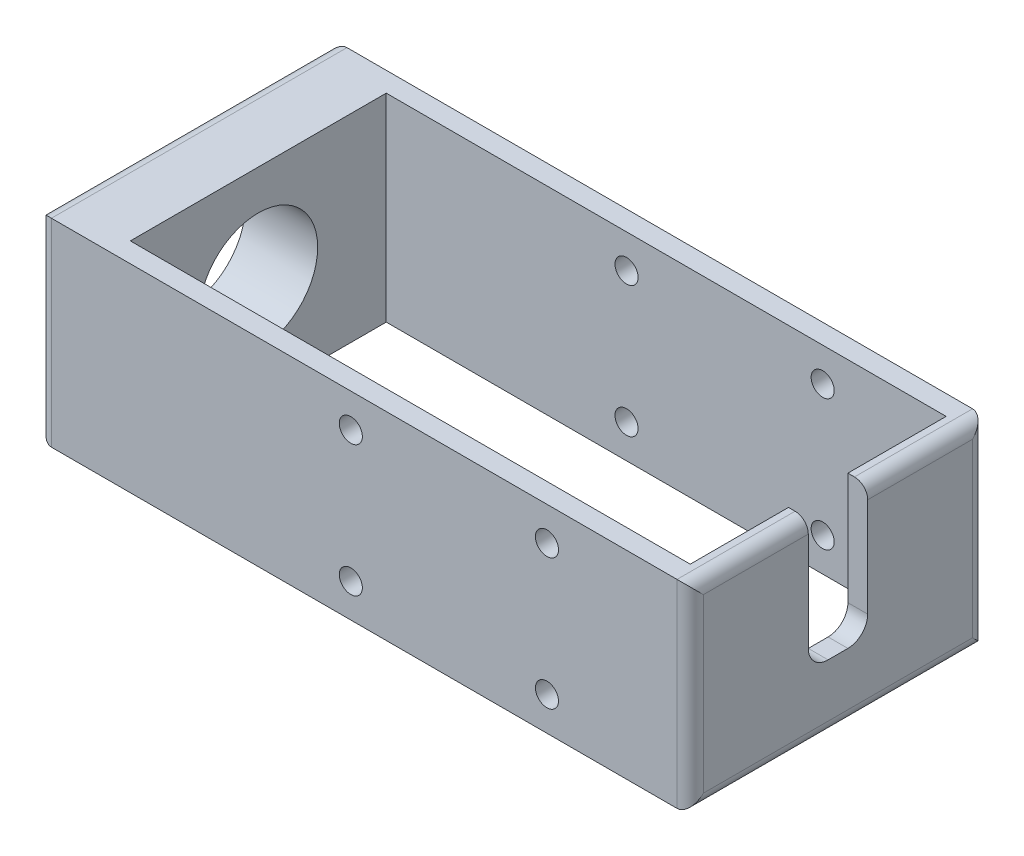
from build123d import *

# Parameters (mm, degrees)
SKETCH1_W                 = 98.79
SKETCH1_H                 = 44.78
BOSS_EXTRUDE1_DEPTH       = 30.05
SHELL1_T                  = -3
SHELL1_THICKNESS_2_FACE_W = 38.78
SHELL1_THICKNESS_2_FACE_H = 30.05
SHELL1_THICKNESS_2_DEPTH  = 7.95
SKETCH2_R                 = 1.75
CUT_EXTRUDE1_DEPTH        = 113.550944021
FILLET1_R                 = 2
CUT_EXTRUDE3_DEPTH        = 29.61
SKETCH5_R                 = 9
CUT_EXTRUDE4_DEPTH        = 20


with BuildPart() as part:
    # Sketch1 → Boss-Extrude1 (new body)
    with BuildSketch(Plane(origin=(0, 0, 0), x_dir=(1, 0, 0), z_dir=(0, 1, 0))):
        with Locations((49.395, 22.39)):
            Rectangle(SKETCH1_W, SKETCH1_H)
    extrude(amount=BOSS_EXTRUDE1_DEPTH)

    # Shell1
    shell1_openings = [part.faces().sort_by_distance(p)[0] for p in [
        (49.395, 30.05, -22.39),
        (49.395, 0, -22.39),
    ]]
    offset(amount=SHELL1_T, openings=shell1_openings, kind=Kind.INTERSECTION)

    # Shell1 thickness 2 face (on inner face of the shell) → Shell1 thickness 2 (add)
    with BuildSketch(Plane(origin=(3, 15.025, -22.39), x_dir=(0, 0, -1), z_dir=(-1, 0, 0))):
        Rectangle(SHELL1_THICKNESS_2_FACE_W, SHELL1_THICKNESS_2_FACE_H)
    extrude(amount=-SHELL1_THICKNESS_2_DEPTH)

    # Sketch2 → Cut-Extrude1 (cut, through all)
    with BuildSketch(Plane.XY):
        with Locations((77.08, 24.95)):
            Circle(SKETCH2_R)
        with Locations((77.08, 5.1)):
            Circle(SKETCH2_R)
        with Locations((47.36, 5.1)):
            Circle(SKETCH2_R)
        with Locations((47.36, 24.95)):
            Circle(SKETCH2_R)
    extrude(amount=-CUT_EXTRUDE1_DEPTH, mode=Mode.SUBTRACT)

    # Fillet1
    fillet1_edges = [part.edges().sort_by_distance(p)[0] for p in [
        (98.79, 30.05, -22.39),
        (0, 30.05, -22.39),
        (98.79, 0, -22.39),
        (0, 0, -22.39),
        (0, 15.025, -44.78),
        (98.79, 15.025, -44.78),
        (98.79, 15.025, 0),
        (0, 15.025, 0),
    ]]
    fillet(fillet1_edges, radius=FILLET1_R)

    # Sketch4 → Cut-Extrude3 (cut)
    with BuildSketch(Plane(origin=(98.79, 0, 0), x_dir=(0, 0, -1), z_dir=(1, 0, 0))):
        with BuildLine():
            Line((17.89, 30.05), (26.89, 30.05))
            Line((26.89, 30.05), (26.89, 13.05))
            ThreePointArc((26.89, 13.05), (26.011320344, 10.928679656), (23.89, 10.05))
            Line((23.89, 10.05), (20.89, 10.05))
            ThreePointArc((20.89, 10.05), (18.768679656, 10.928679656), (17.89, 13.05))
            Line((17.89, 13.05), (17.89, 30.05))
        make_face()
    extrude(amount=-CUT_EXTRUDE3_DEPTH, mode=Mode.SUBTRACT)

    # Sketch5 → Cut-Extrude4 (cut)
    with BuildSketch(Plane.ZY):
        with Locations((-22.39, 15.025)):
            Circle(SKETCH5_R)
    extrude(amount=-CUT_EXTRUDE4_DEPTH, mode=Mode.SUBTRACT)


solid = part.part
